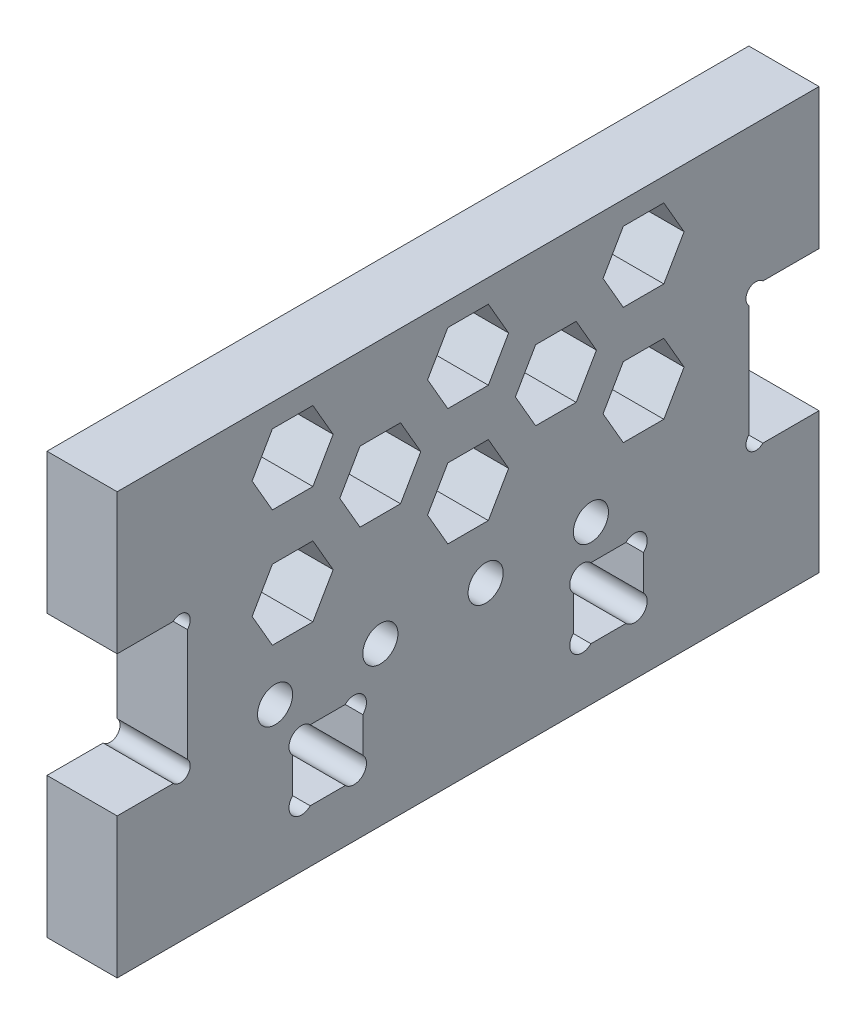
from build123d import *

# Parameters (mm, degrees)
SKETCH3_W                 = 101.6
SKETCH3_H                 = 76.2
SQUARE_EXTRUSION_DEPTH    = 12.7
SKETCH4_R                 = 2.24536
SKETCH4_W                 = 12.7
SKETCH4_H                 = 12.7
SLOTTING_HOLES_DEPTH      = 12.7
HONEYCOMB_POCKETING_DEPTH = 12.7
SKETCH14_W                = 12.7
SKETCH14_H                = 25.4
TAB_EXTRUSION_DEPTH       = 12.7
CUT_EXTRUDE2_START        = -12.7
SKETCH15_R                = 1.796051224
CUT_EXTRUDE2_DEPTH        = 12.7
CUT_EXTRUDE3_REACH        = 77.134
SKETCH16_R                = 3.175


with BuildPart() as part:
    # Sketch3 → Square Extrusion (new body)
    with BuildSketch(Plane(origin=(0, 0, 0), x_dir=(0, 0, -1), z_dir=(1, 0, 0))):
        Rectangle(SKETCH3_W, SKETCH3_H)
    extrude(amount=SQUARE_EXTRUSION_DEPTH)

    # Sketch4 → Slotting Holes (cut)
    with BuildSketch(Plane(origin=(12.7, 0, 0), x_dir=(0, 0, -1), z_dir=(1, 0, 0))):
        with BuildLine():
            ThreePointArc((-28.574581463, -15.875), (-31.750209282, -15.874790718), (-31.75, -19.050418537))
            Line((-31.75, -19.050418537), (-31.75, -15.875))
            Line((-31.75, -15.875), (-28.574581463, -15.875))
        make_face()
        with BuildLine():
            Line((-31.75, -15.875), (-31.75, -19.050418537))
            ThreePointArc((-31.75, -19.050418537), (-29.303101219, -19.536885515), (-27.91714, -17.4625))
            ThreePointArc((-27.91714, -17.4625), (-28.08800123, -16.603374641), (-28.574581463, -15.875))
            Line((-28.574581463, -15.875), (-31.75, -15.875))
        make_face()
        with Locations((-30.1625, -26.9875)):
            Circle(SKETCH4_R)
        with Locations((-20.6375, -26.9875)):
            Circle(SKETCH4_R)
        with Locations((-20.6375, -17.4625)):
            Circle(SKETCH4_R)
        with Locations((-30.1625, -17.4625)):
            Circle(SKETCH4_R)
        with Locations((-25.4, -22.225)):
            Rectangle(SKETCH4_W, SKETCH4_H)
        with BuildLine():
            ThreePointArc((-22.225418537, -15.875), (-22.225209282, -19.050209282), (-19.05, -19.050418537))
            Line((-19.05, -19.050418537), (-19.05, -15.875))
            Line((-19.05, -15.875), (-22.225418537, -15.875))
        make_face()
        with BuildLine():
            Line((-19.05, -15.875), (-19.05, -19.050418537))
            ThreePointArc((-19.05, -19.050418537), (-18.563114485, -18.321898781), (-18.39214, -17.4625))
            ThreePointArc((-18.39214, -17.4625), (-19.778374641, -15.38800123), (-22.225418537, -15.875))
            Line((-22.225418537, -15.875), (-19.05, -15.875))
        make_face()
        with BuildLine():
            Line((-31.75, -25.399581463), (-31.75, -28.575))
            Line((-31.75, -28.575), (-28.574581463, -28.575))
            ThreePointArc((-28.574581463, -28.575), (-28.08800123, -27.846625359), (-27.91714, -26.9875))
            ThreePointArc((-27.91714, -26.9875), (-29.303101219, -24.913114485), (-31.75, -25.399581463))
        make_face()
        with BuildLine():
            Line((-28.574581463, -28.575), (-31.75, -28.575))
            Line((-31.75, -28.575), (-31.75, -25.399581463))
            ThreePointArc((-31.75, -25.399581463), (-31.750209282, -28.575209282), (-28.574581463, -28.575))
        make_face()
        with BuildLine():
            ThreePointArc((-19.05, -25.399581463), (-22.225209282, -25.399790718), (-22.225418537, -28.575))
            Line((-22.225418537, -28.575), (-19.05, -28.575))
            Line((-19.05, -28.575), (-19.05, -25.399581463))
        make_face()
        with BuildLine():
            Line((-19.05, -28.575), (-22.225418537, -28.575))
            ThreePointArc((-22.225418537, -28.575), (-19.778374641, -29.06199877), (-18.39214, -26.9875))
            ThreePointArc((-18.39214, -26.9875), (-18.563114485, -26.128101219), (-19.05, -25.399581463))
            Line((-19.05, -25.399581463), (-19.05, -28.575))
        make_face()
        with BuildLine():
            ThreePointArc((22.88286, -17.4625), (22.71199877, -16.603374641), (22.225418537, -15.875))
            Line((22.225418537, -15.875), (19.05, -15.875))
            Line((19.05, -15.875), (19.05, -19.050418537))
            ThreePointArc((19.05, -19.050418537), (21.496898781, -19.536885515), (22.88286, -17.4625))
        make_face()
        with BuildLine():
            Line((19.05, -15.875), (22.225418537, -15.875))
            ThreePointArc((22.225418537, -15.875), (19.049790718, -15.874790718), (19.05, -19.050418537))
            Line((19.05, -19.050418537), (19.05, -15.875))
        make_face()
        with Locations((30.1625, -17.4625)):
            Circle(SKETCH4_R)
        with Locations((20.6375, -17.4625)):
            Circle(SKETCH4_R)
        with Locations((20.6375, -26.9875)):
            Circle(SKETCH4_R)
        with Locations((30.1625, -26.9875)):
            Circle(SKETCH4_R)
        with Locations((25.4, -22.225)):
            Rectangle(SKETCH4_W, SKETCH4_H)
        with BuildLine():
            Line((31.75, -19.050418537), (31.75, -15.875))
            Line((31.75, -15.875), (28.574581463, -15.875))
            ThreePointArc((28.574581463, -15.875), (28.574790718, -19.050209282), (31.75, -19.050418537))
        make_face()
        with BuildLine():
            Line((28.574581463, -15.875), (31.75, -15.875))
            Line((31.75, -15.875), (31.75, -19.050418537))
            ThreePointArc((31.75, -19.050418537), (32.236885515, -18.321898781), (32.40786, -17.4625))
            ThreePointArc((32.40786, -17.4625), (31.021625359, -15.38800123), (28.574581463, -15.875))
        make_face()
        with BuildLine():
            ThreePointArc((32.40786, -26.9875), (32.236885515, -26.128101219), (31.75, -25.399581463))
            Line((31.75, -25.399581463), (31.75, -28.575))
            Line((31.75, -28.575), (28.574581463, -28.575))
            ThreePointArc((28.574581463, -28.575), (31.021625359, -29.06199877), (32.40786, -26.9875))
        make_face()
        with BuildLine():
            Line((31.75, -28.575), (31.75, -25.399581463))
            ThreePointArc((31.75, -25.399581463), (28.574790718, -25.399790718), (28.574581463, -28.575))
            Line((28.574581463, -28.575), (31.75, -28.575))
        make_face()
        with BuildLine():
            ThreePointArc((22.88286, -26.9875), (21.496898781, -24.913114485), (19.05, -25.399581463))
            Line((19.05, -25.399581463), (19.05, -28.575))
            Line((19.05, -28.575), (22.225418537, -28.575))
            ThreePointArc((22.225418537, -28.575), (22.71199877, -27.846625359), (22.88286, -26.9875))
        make_face()
        with BuildLine():
            Line((19.05, -28.575), (19.05, -25.399581463))
            ThreePointArc((19.05, -25.399581463), (19.049790718, -28.575209282), (22.225418537, -28.575))
            Line((22.225418537, -28.575), (19.05, -28.575))
        make_face()
    extrude(amount=-SLOTTING_HOLES_DEPTH, mode=Mode.SUBTRACT)

    # Sketch9 → Honeycomb Pocketing (cut)
    with BuildSketch(Plane(origin=(12.7, 0, 0), x_dir=(0, 0, -1), z_dir=(1, 0, 0))):
        Polygon((-35.416174209, 21.20738686), (-28.083825791, 21.20738686), (-24.417651581, 27.55738686), (-28.083825791, 33.90738686), (-35.416174209, 33.90738686), (-39.082348419, 27.55738686), align=None)
        Polygon((-3.666174209, 0), (3.666174209, 0), (7.332348419, 6.35), (3.666174209, 12.7), (-3.666174209, 12.7), (-7.332348419, 6.35), align=None)
        Polygon((-35.416174209, 0), (-28.083825791, 0), (-24.417651581, 6.35), (-28.083825791, 12.7), (-35.416174209, 12.7), (-39.082348419, 6.35), align=None)
        Polygon((28.083825791, 0), (35.416174209, 0), (39.082348419, 6.35), (35.416174209, 12.7), (28.083825791, 12.7), (24.417651581, 6.35), align=None)
        Polygon((-3.666174209, 21.20738686), (3.666174209, 21.20738686), (7.332348419, 27.55738686), (3.666174209, 33.90738686), (-3.666174209, 33.90738686), (-7.332348419, 27.55738686), align=None)
        Polygon((28.083825791, 21.20738686), (35.416174209, 21.20738686), (39.082348419, 27.55738686), (35.416174209, 33.90738686), (28.083825791, 33.90738686), (24.417651581, 27.55738686), align=None)
        Polygon((19.556437025, 10.577257458), (12.224088606, 10.577257458), (8.557914397, 16.927257458), (12.224088606, 23.277257458), (19.556437025, 23.277257458), (23.222611234, 16.927257458), align=None)
        Polygon((-12.224088606, 10.577257458), (-8.557914397, 16.927257458), (-12.224088606, 23.277257458), (-19.556437025, 23.277257458), (-23.222611234, 16.927257458), (-19.556437025, 10.577257458), align=None)
    extrude(amount=-HONEYCOMB_POCKETING_DEPTH, mode=Mode.SUBTRACT)

    # Sketch14 → Tab Extrusion (add)
    with BuildSketch(Plane(origin=(12.7, 0, 0), x_dir=(0, 0, -1), z_dir=(1, 0, 0))):
        with Locations((-57.15, 25.4)):
            Rectangle(SKETCH14_W, SKETCH14_H)
        with Locations((-57.15, -25.4)):
            Rectangle(SKETCH14_W, SKETCH14_H)
        with Locations((57.15, -25.4)):
            Rectangle(SKETCH14_W, SKETCH14_H)
        with Locations((57.15, 25.4)):
            Rectangle(SKETCH14_W, SKETCH14_H)
    extrude(amount=-TAB_EXTRUSION_DEPTH)

    # Sketch15 → Cut-Extrude2 (cut)
    with BuildSketch(Plane(origin=(12.7, 0, 0), x_dir=(0, 0, -1), z_dir=(1, 0, 0)).offset(CUT_EXTRUDE2_START)):
        with Locations((-52.07, 11.43)):
            Circle(SKETCH15_R)
        with Locations((-52.07, -11.43)):
            Circle(SKETCH15_R)
        with Locations((52.07, -11.43)):
            Circle(SKETCH15_R)
        with Locations((52.07, 11.43)):
            Circle(SKETCH15_R)
    extrude(amount=CUT_EXTRUDE2_DEPTH, mode=Mode.SUBTRACT)

    # Sketch16 → Cut-Extrude3 (cut, up to next)
    with BuildSketch(Plane(origin=(12.7, 0, 0), x_dir=(0, 0, -1), z_dir=(1, 0, 0)), mode=Mode.PRIVATE) as cut_extrude3_sk1:
        with Locations((-34.925, -9.525)):
            Circle(SKETCH16_R)
    cut_extrude3_tool1 = extrude(cut_extrude3_sk1.sketch, amount=-CUT_EXTRUDE3_REACH, mode=Mode.PRIVATE) & part.part
    # Sketch16 → Cut-Extrude3 (cut, up to next)
    with BuildSketch(Plane(origin=(12.7, 0, 0), x_dir=(0, 0, -1), z_dir=(1, 0, 0)), mode=Mode.PRIVATE) as cut_extrude3_sk2:
        with Locations((-15.875, -9.525)):
            Circle(SKETCH16_R)
    cut_extrude3_tool2 = extrude(cut_extrude3_sk2.sketch, amount=-CUT_EXTRUDE3_REACH, mode=Mode.PRIVATE) & part.part
    # Sketch16 → Cut-Extrude3 (cut, up to next)
    with BuildSketch(Plane(origin=(12.7, 0, 0), x_dir=(0, 0, -1), z_dir=(1, 0, 0)), mode=Mode.PRIVATE) as cut_extrude3_sk3:
        with Locations((3.175, -9.525)):
            Circle(SKETCH16_R)
    cut_extrude3_tool3 = extrude(cut_extrude3_sk3.sketch, amount=-CUT_EXTRUDE3_REACH, mode=Mode.PRIVATE) & part.part
    # Sketch16 → Cut-Extrude3 (cut, up to next)
    with BuildSketch(Plane(origin=(12.7, 0, 0), x_dir=(0, 0, -1), z_dir=(1, 0, 0)), mode=Mode.PRIVATE) as cut_extrude3_sk4:
        with Locations((22.225, -9.525)):
            Circle(SKETCH16_R)
    cut_extrude3_tool4 = extrude(cut_extrude3_sk4.sketch, amount=-CUT_EXTRUDE3_REACH, mode=Mode.PRIVATE) & part.part
    add(cut_extrude3_tool1.solids().sort_by_distance((12.7, -9.525, 34.925))[0], mode=Mode.SUBTRACT)
    add(cut_extrude3_tool2.solids().sort_by_distance((12.7, -9.525, 15.875))[0], mode=Mode.SUBTRACT)
    add(cut_extrude3_tool3.solids().sort_by_distance((12.7, -9.525, -3.175))[0], mode=Mode.SUBTRACT)
    add(cut_extrude3_tool4.solids().sort_by_distance((12.7, -9.525, -22.225))[0], mode=Mode.SUBTRACT)


solid = part.part
